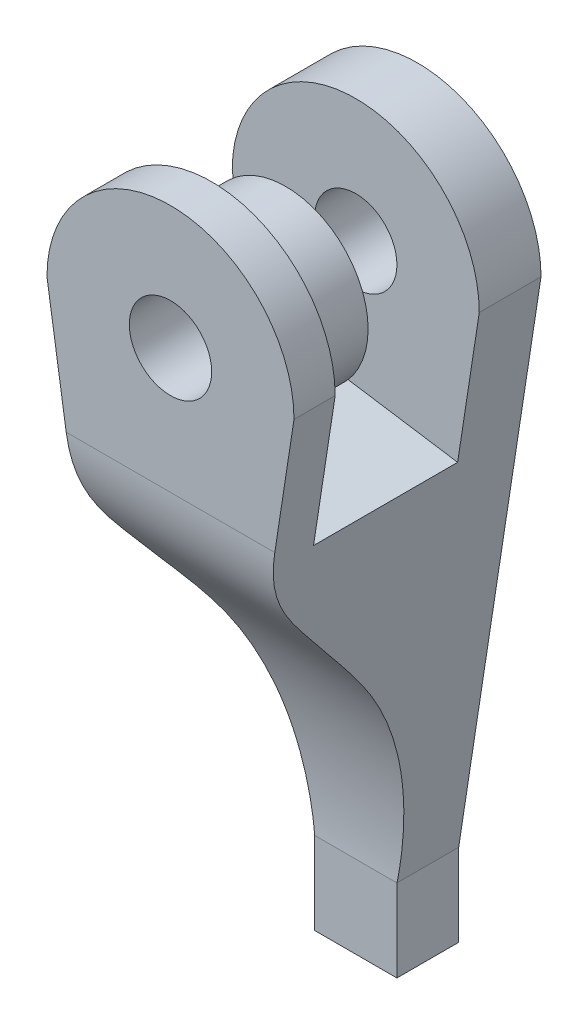
from build123d import *

# Parameters (mm, degrees)
ESQUISSE1_R                  = 5
ESQUISSE1_W                  = 10
ESQUISSE1_H                  = 10
BOSS_EXTRU_1_DEPTH           = 7.5
ESQUISSE2_R                  = 5
BOSS_EXTRU_2_DEPTH           = 5
BOSS_EXTRU_3_DEPTH           = 17.5
ENL_V_MAT_EXTRU_1_DEPTH      = 83.158383626
ENL_V_MAT_EXTRU_1_DEPTH_BACK = 83.158383626
BOSS_EXTRU_4_START           = 9
ESQUISSE5_R                  = 10
ESQUISSE5_R_2                = 5
BOSS_EXTRU_4_DEPTH           = 9


with BuildPart() as part:
    # Esquisse1 → Boss.-Extru.1 (new body)
    # profile 1 of 3: a face of its own
    with BuildSketch(Plane.XY):
        with BuildLine():
            ThreePointArc((14.306358382, -4.50867052), (0, -15), (-14.306358382, -4.50867052))
            Line((-14.306358382, -4.50867052), (-5, -65))
            Line((-5, -65), (5, -65))
            Line((5, -65), (14.306358382, -4.50867052))
        make_face()
    # profile 2 of 3: a face of its own
    with BuildSketch(Plane.XY):
        with BuildLine():
            ThreePointArc((15, 0), (0, 15), (-15, 0))
            Line((-15, 0), (-14.306358382, -4.50867052))
            ThreePointArc((-14.306358382, -4.50867052), (0, -15), (14.306358382, -4.50867052))
            Line((14.306358382, -4.50867052), (15, 0))
        make_face()
        Circle(ESQUISSE1_R, mode=Mode.SUBTRACT)
    # profile 3 of 3: a face of its own
    with BuildSketch(Plane.XY):
        with Locations((0, -70)):
            Rectangle(ESQUISSE1_W, ESQUISSE1_H)
    extrude(amount=BOSS_EXTRU_1_DEPTH)



with BuildPart() as body_2:
    # Esquisse2 → Boss.-Extru.2 (new body)
    # profile 1 of 2: a face of its own
    with BuildSketch(Plane.XY.offset(25)):
        with BuildLine():
            ThreePointArc((14.306358382, -4.50867052), (0, -15), (-14.306358382, -4.50867052))
            Line((-14.306358382, -4.50867052), (-5, -65))
            Line((-5, -65), (5, -65))
            Line((5, -65), (14.306358382, -4.50867052))
        make_face()
    # profile 2 of 2: a face of its own
    with BuildSketch(Plane.XY.offset(25)):
        with BuildLine():
            ThreePointArc((15, 0), (0, 15), (-15, 0))
            Line((-15, 0), (-14.306358382, -4.50867052))
            ThreePointArc((-14.306358382, -4.50867052), (0, -15), (14.306358382, -4.50867052))
            Line((14.306358382, -4.50867052), (15, 0))
        make_face()
        Circle(ESQUISSE2_R, mode=Mode.SUBTRACT)
    extrude(amount=BOSS_EXTRU_2_DEPTH)


with BuildPart() as part_1:
    add(part.part)

    add(body_2.part)  # Boss.-Extru.3 merges body 2
    # Esquisse3 → Boss.-Extru.3 (add)
    with BuildSketch(Plane(origin=(0, 0, 25), x_dir=(-1, 0, 0), z_dir=(0, 0, -1))):
        Polygon((12.972191557, -13.180754881), (-12.372321427, -17.079910725), (-5, -65), (5, -65), align=None)
    extrude(amount=BOSS_EXTRU_3_DEPTH)

    # Esquisse4 → Enlèv. mat.-Extru.1 (cut, two sides: drawn at the far end of the back side and taken through both)
    with BuildSketch(Plane(origin=(0, 0, 0), x_dir=(0, 0, -1), z_dir=(1, 0, 0)).offset(-ENL_V_MAT_EXTRU_1_DEPTH_BACK)):
        with BuildLine():
            Line((-30, -15.176476659), (-30, -65))
            Line((-30, -65), (-7.5, -65))
            add(Edge.make_bspline(
                [(-7.5, -65), (-7.5, -64.789009401), (-5.808728882, -48.116944639), (-22.947732818, -29.702706462), (-30, -20.554677266), (-30, -15.176476659)],
                knots=[0, 0, 0, 0, 0.665017027, 0.876258151, 1, 1, 1, 1], degree=3))
        make_face()
    extrude(amount=ENL_V_MAT_EXTRU_1_DEPTH + ENL_V_MAT_EXTRU_1_DEPTH_BACK, mode=Mode.SUBTRACT)

    # Esquisse5 → Boss.-Extru.4 (add)
    with BuildSketch(Plane(origin=(0, 0, 25), x_dir=(-1, 0, 0), z_dir=(0, 0, -1)).offset(BOSS_EXTRU_4_START)):
        with Locations(Location((0, 0, 0), (0, 0, 180))):
            Circle(ESQUISSE5_R)
        with Locations(Location((0, 0, 0), (0, 0, 180))):
            Circle(ESQUISSE5_R_2, mode=Mode.SUBTRACT)
    extrude(amount=-BOSS_EXTRU_4_DEPTH)


solid = part_1.part
